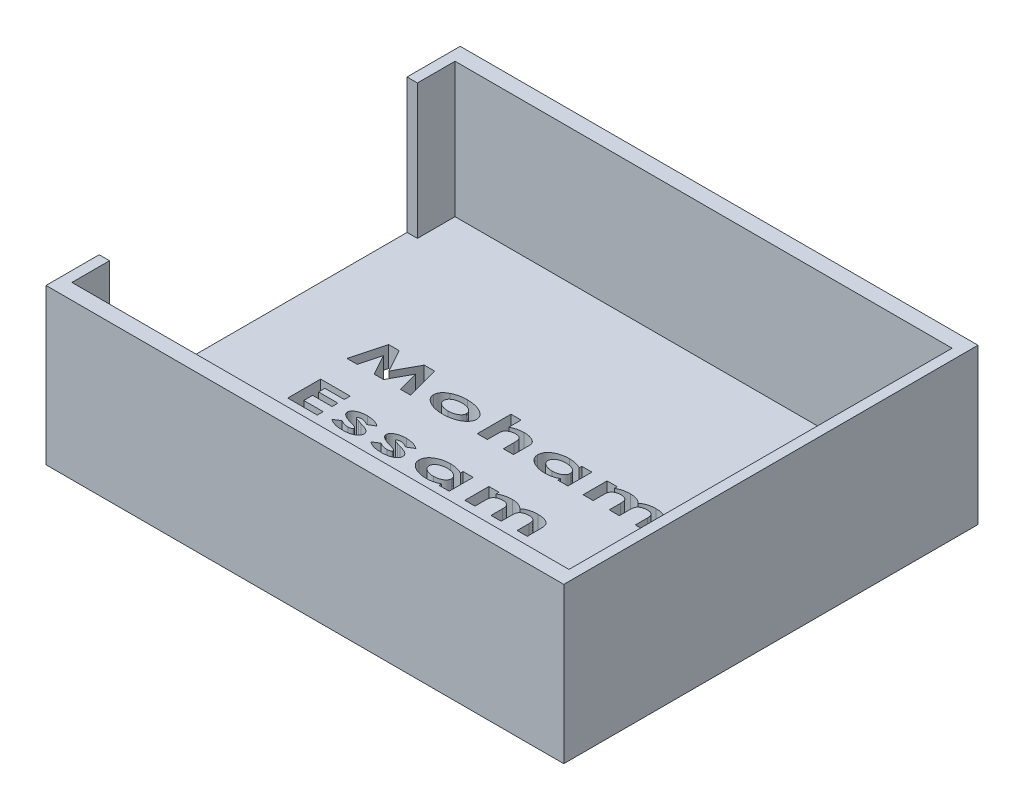
from build123d import *

# Parameters (mm, degrees)
SKETCH1_W           = 50
SKETCH1_H           = 40
BOSS_EXTRUDE1_DEPTH = 15
SKETCH2_W           = 48
SKETCH2_H           = 37
CUT_EXTRUDE1_DEPTH  = 13
SKETCH3_W           = 29.732137494
SKETCH3_H           = 13
CUT_EXTRUDE2_DEPTH  = 12
CUT_EXTRUDE3_DEPTH  = 12


with BuildPart() as part:
    # Sketch1 → Boss-Extrude1 (new body)
    with BuildSketch(Plane(origin=(0, 0, 0), x_dir=(1, 0, 0), z_dir=(0, 1, 0))):
        Rectangle(SKETCH1_W, SKETCH1_H)
    extrude(amount=BOSS_EXTRUDE1_DEPTH)

    # Sketch2 → Cut-Extrude1 (cut)
    with BuildSketch(Plane(origin=(0, 15, 0), x_dir=(1, 0, 0), z_dir=(0, 1, 0))):
        Rectangle(SKETCH2_W, SKETCH2_H)
    extrude(amount=-CUT_EXTRUDE1_DEPTH, mode=Mode.SUBTRACT)

    # Sketch3 → Cut-Extrude2 (cut)
    with BuildSketch(Plane.ZY.offset(25)):
        with Locations((0, 8.5)):
            Rectangle(SKETCH3_W, SKETCH3_H)
    extrude(amount=-CUT_EXTRUDE2_DEPTH, mode=Mode.SUBTRACT)

    # Sketch4 → Cut-Extrude3 (cut)
    # profile 1 of 12: a face of its own
    with BuildSketch(Plane(origin=(0, 2, 0), x_dir=(1, 0, 0), z_dir=(0, 1, 0))):
        Polygon((-16.508154695, 4.600076548), (-15.484802331, 4.600076548), (-14.284001049, 2.385463167), (-13.07683959, 4.600076548), (-12.058575368, 4.600076548), (-11.210763869, 1.425076548), (-12.201679334, 1.425076548), (-12.737206177, 3.43044013), (-13.83052048, 1.425076548), (-14.743205776, 1.425076548), (-15.83079592, 3.43044013), (-16.366958781, 1.425076548), (-17.357238228, 1.425076548), align=None)
    # profile 2 of 12: a face of its own
    with BuildSketch(Plane(origin=(0, 2, 0), x_dir=(1, 0, 0), z_dir=(0, 1, 0))):
        with BuildLine():
            add(Edge.make_bspline(
                [(-8.10000165, 3.785973984), (-8.053562428, 3.785489208), (-7.961468846, 3.784527849), (-7.824403004, 3.776708666), (-7.689529994, 3.763783784), (-7.556586802, 3.74709731), (-7.425933532, 3.72394361), (-7.297468849, 3.695737596), (-7.170741046, 3.6638278), (-7.047494285, 3.62540631), (-6.928283743, 3.58391314), (-6.815009744, 3.538346267), (-6.708702086, 3.488375369), (-6.608307621, 3.436147194), (-6.515853623, 3.378492345), (-6.42901348, 3.318812605), (-6.349761787, 3.254521759), (-6.277181302, 3.187272142), (-6.212381986, 3.117661475), (-6.155908031, 3.046029153), (-6.10815106, 2.973053869), (-6.068835751, 2.898571872), (-6.038053784, 2.822786278), (-6.016320478, 2.745363924), (-6.003220321, 2.666605185), (-6.001413146, 2.613629928), (-6.000507459, 2.587080755)],
                knots=[0, 0, 0, 0, 1.265940792, 2.510486111, 3.741199044, 4.959170855, 6.162116729, 7.356968714, 8.544276639, 9.723439993, 10.875014664, 11.984755685, 13.050035749, 14.076429324, 15.067691783, 16.018447118, 16.947253998, 17.846941071, 18.713956268, 19.537177321, 20.330687547, 21.088166391, 21.829780047, 22.55619397, 23.276419638, 24, 24, 24, 24], degree=3))
            add(Edge.make_bspline(
                [(-6.000507459, 2.587080755), (-6.001435222, 2.560326746), (-6.003286397, 2.506944182), (-6.016063779, 2.427394854), (-6.039069884, 2.349751761), (-6.068647982, 2.272596784), (-6.108608363, 2.197714671), (-6.1568353, 2.123963395), (-6.213642087, 2.051420904), (-6.27883962, 1.980722143), (-6.351618259, 1.91286538), (-6.430303069, 1.847510177), (-6.51675085, 1.78770179), (-6.60817184, 1.72994889), (-6.706583218, 1.677332148), (-6.811206668, 1.628514229), (-6.92175677, 1.582464278), (-7.038479354, 1.541589111), (-7.159703989, 1.504902188), (-7.284384093, 1.472296157), (-7.4121687, 1.445098743), (-7.543069938, 1.422720048), (-7.676976482, 1.405636131), (-7.814056398, 1.393826636), (-7.954045287, 1.385751027), (-8.048472685, 1.384834519), (-8.096185544, 1.38437142)],
                knots=[0, 0, 0, 0, 0.728759206, 1.454101135, 2.18705835, 2.931303608, 3.701078261, 4.493944655, 5.329151475, 6.207866333, 7.110765712, 8.037992116, 8.991287713, 9.971932766, 10.982209905, 12.02848696, 13.115947981, 14.242882043, 15.39562174, 16.565191902, 17.752210956, 18.953195421, 20.181634505, 21.42807642, 22.700442589, 24, 24, 24, 24], degree=3))
            add(Edge.make_bspline(
                [(-8.096185544, 1.38437142), (-8.165963589, 1.385547755), (-8.302946767, 1.387857049), (-8.504543687, 1.403743579), (-8.698240887, 1.431061007), (-8.884343086, 1.469199363), (-9.062872451, 1.517754125), (-9.233037538, 1.578732885), (-9.39600828, 1.64908609), (-9.524972418, 1.717561424), (-9.62240231, 1.776955934), (-9.691063256, 1.82210292), (-9.754301929, 1.86911454), (-9.81321749, 1.916932134), (-9.867395808, 1.965942787), (-9.916895637, 2.016027204), (-9.962026386, 2.067195271), (-10.001707222, 2.120016539), (-10.038050363, 2.173460555), (-10.068113185, 2.228959314), (-10.094732349, 2.284984096), (-10.115534491, 2.342591168), (-10.132305998, 2.400966431), (-10.143652178, 2.460802409), (-10.150832946, 2.521607976), (-10.151897174, 2.562680317), (-10.152430536, 2.583264649)],
                knots=[0, 0, 0, 0, 1.927555344, 3.784036287, 5.582177344, 7.328045527, 9.028781886, 10.688537513, 12.31733635, 13.92860432, 14.717078596, 15.469149608, 16.197730675, 16.892896808, 17.564600043, 18.214792588, 18.837361948, 19.447633942, 20.038893574, 20.620826713, 21.1894036, 21.750816835, 22.310731212, 22.865506817, 23.431423114, 24, 24, 24, 24], degree=3))
            add(Edge.make_bspline(
                [(-10.152430536, 2.583264649), (-10.152007359, 2.605341934), (-10.151166096, 2.649230965), (-10.142384734, 2.714287312), (-10.129241039, 2.777924271), (-10.110548875, 2.839991347), (-10.087045263, 2.900750171), (-10.05760248, 2.960096865), (-10.022398918, 3.017952028), (-9.98218917, 3.07466042), (-9.937050876, 3.130020742), (-9.886417771, 3.183734582), (-9.830324779, 3.235738292), (-9.769101046, 3.286575336), (-9.702984247, 3.336525613), (-9.630590329, 3.383709534), (-9.553938975, 3.431377077), (-9.499633485, 3.460224657), (-9.471891674, 3.474961364)],
                knots=[0, 0, 0, 0, 0.895362313, 1.779955521, 2.659009477, 3.529985937, 4.407059137, 5.299648078, 6.214390826, 7.152461182, 8.118516572, 9.110538608, 10.145320296, 11.220372081, 12.338748077, 13.505510881, 14.725697036, 16, 16, 16, 16], degree=3))
            add(Edge.make_bspline(
                [(-9.471891674, 3.474961364), (-9.421566571, 3.50009899), (-9.320574494, 3.550545007), (-9.162194855, 3.612752277), (-8.998958602, 3.666501531), (-8.830120902, 3.710497895), (-8.655431521, 3.743995745), (-8.475149363, 3.76800533), (-8.289364506, 3.782994341), (-8.163631618, 3.78497276), (-8.10000165, 3.785973984)],
                knots=[0, 0, 0, 0, 0.950148044, 1.906750665, 2.871947648, 3.85293107, 4.852697354, 5.875609384, 6.924904138, 8, 8, 8, 8], degree=3))
        make_face()
        with BuildLine():
            add(Edge.make_bspline(
                [(-8.07837705, 3.256807318), (-8.116757977, 3.256069947), (-8.19212421, 3.254622019), (-8.302699674, 3.24701239), (-8.408074425, 3.23101742), (-8.50899592, 3.211317667), (-8.604649772, 3.184287755), (-8.696056331, 3.152875875), (-8.781576209, 3.113650589), (-8.862005113, 3.070382317), (-8.935200134, 3.022528376), (-8.998813053, 2.970167759), (-9.053981429, 2.915541409), (-9.098082484, 2.856383054), (-9.133144522, 2.794361583), (-9.157419471, 2.728419611), (-9.172504154, 2.659419985), (-9.174500789, 2.612173628), (-9.175507459, 2.58835279)],
                knots=[0, 0, 0, 0, 1.29966981, 2.552080606, 3.748873556, 4.905985143, 6.03097135, 7.111551771, 8.174877936, 9.212306099, 10.201717801, 11.129954838, 11.997870153, 12.823312326, 13.620172785, 14.401461113, 15.194042922, 16, 16, 16, 16], degree=3))
            add(Edge.make_bspline(
                [(-9.175507459, 2.58835279), (-9.174454075, 2.563697822), (-9.172384425, 2.515256632), (-9.158261848, 2.444408375), (-9.13373495, 2.377313221), (-9.09894645, 2.314212554), (-9.055076125, 2.254422904), (-9.001849616, 2.198042925), (-8.93831291, 2.145984075), (-8.865819417, 2.098135538), (-8.786370339, 2.0544479), (-8.700506269, 2.017250089), (-8.610214228, 1.984416146), (-8.514379173, 1.95864523), (-8.413678001, 1.938345456), (-8.307713577, 1.923601065), (-8.196586829, 1.915652268), (-8.120789802, 1.914251416), (-8.082193156, 1.913538087)],
                knots=[0, 0, 0, 0, 0.83184601, 1.634380945, 2.426517084, 3.233281859, 4.05749425, 4.922902993, 5.842558818, 6.822747909, 7.850475165, 8.897933112, 9.977348038, 11.089826779, 12.243123404, 13.442047824, 14.697463782, 16, 16, 16, 16], degree=3))
            add(Edge.make_bspline(
                [(-8.082193156, 1.913538087), (-8.043378166, 1.914162533), (-7.967551664, 1.915382411), (-7.856284595, 1.924514963), (-7.75009272, 1.938995828), (-7.648610368, 1.959048019), (-7.552241009, 1.986061128), (-7.460691956, 2.018167068), (-7.374092403, 2.056596825), (-7.293441262, 2.10060863), (-7.219942048, 2.149220839), (-7.154920144, 2.2011632), (-7.100540867, 2.257622567), (-7.055298944, 2.316880751), (-7.020638612, 2.379998897), (-6.995318805, 2.446232277), (-6.980442226, 2.51624969), (-6.978442938, 2.564114802), (-6.977430536, 2.58835279)],
                knots=[0, 0, 0, 0, 1.303383627, 2.546207562, 3.746413811, 4.901138048, 6.017018097, 7.104649258, 8.156456738, 9.195146267, 10.186416423, 11.112656285, 11.983731231, 12.812460638, 13.609099142, 14.393231776, 15.186362949, 16, 16, 16, 16], degree=3))
            add(Edge.make_bspline(
                [(-6.977430536, 2.58835279), (-6.978493109, 2.612584736), (-6.980589596, 2.66039505), (-6.994707035, 2.73038559), (-7.019038487, 2.796754377), (-7.054237774, 2.858767746), (-7.097844073, 2.918071405), (-7.15175573, 2.973401507), (-7.21545427, 3.024934261), (-7.287533559, 3.073051342), (-7.367584371, 3.115532414), (-7.452895166, 3.154265336), (-7.544190511, 3.185634955), (-7.640633108, 3.21187167), (-7.742459959, 3.231958845), (-7.849677462, 3.246752112), (-7.962289188, 3.254705976), (-8.039144707, 3.256097161), (-8.07837705, 3.256807318)],
                knots=[0, 0, 0, 0, 0.816368961, 1.610719063, 2.394983412, 3.188047637, 4.005291257, 4.869189981, 5.782951973, 6.761698352, 7.784500958, 8.833316183, 9.915489392, 11.033223085, 12.198828477, 13.410141754, 14.677958211, 16, 16, 16, 16], degree=3))
        make_face(mode=Mode.SUBTRACT)
    # profile 3 of 12: a face of its own
    with BuildSketch(Plane(origin=(0, 2, 0), x_dir=(1, 0, 0), z_dir=(0, 1, 0))):
        with BuildLine():
            Line((-4.779353613, 4.681486805), (-3.802430536, 4.681486805))
            Line((-3.802430536, 4.681486805), (-3.802430536, 3.494041893))
            add(Edge.make_bspline(
                [(-3.802430536, 3.494041893), (-3.754162301, 3.517567459), (-3.658421105, 3.564230982), (-3.511393478, 3.622472835), (-3.364617901, 3.673646447), (-3.216832153, 3.714052605), (-3.068430251, 3.746092043), (-2.919334, 3.768830744), (-2.769412815, 3.783600583), (-2.66908147, 3.785181652), (-2.61880173, 3.785973984)],
                knots=[0, 0, 0, 0, 1.047184241, 2.077114959, 3.082937762, 4.078323519, 5.063942948, 6.043145874, 7.019348174, 8, 8, 8, 8], degree=3))
            add(Edge.make_bspline(
                [(-2.61880173, 3.785973984), (-2.570656951, 3.785210247), (-2.476152038, 3.783711082), (-2.337242103, 3.772845341), (-2.204045024, 3.754538321), (-2.07651281, 3.728587774), (-1.954838863, 3.694712612), (-1.83880068, 3.654281608), (-1.728676905, 3.605851682), (-1.659214689, 3.567695317), (-1.624706177, 3.548739409)],
                knots=[0, 0, 0, 0, 1.117423547, 2.193426107, 3.23173755, 4.236375021, 5.211771812, 6.161126484, 7.086456043, 8, 8, 8, 8], degree=3))
            add(Edge.make_bspline(
                [(-1.624706177, 3.548739409), (-1.597035703, 3.531453485), (-1.543190864, 3.497816266), (-1.473006417, 3.436150923), (-1.412060505, 3.370138183), (-1.363702793, 3.296505668), (-1.324723573, 3.217914866), (-1.298434246, 3.132626476), (-1.281043107, 3.041695451), (-1.279503015, 2.978741058), (-1.278712587, 2.946430715)],
                knots=[0, 0, 0, 0, 1.070617537, 2.083348098, 3.060132992, 4.014797615, 4.968368213, 5.933552875, 6.939428801, 8, 8, 8, 8], degree=3))
            Line((-1.278712587, 2.946430715), (-1.278712587, 1.425076548))
            Line((-1.278712587, 1.425076548), (-2.255635664, 1.425076548))
            Line((-2.255635664, 1.425076548), (-2.255635664, 2.433800507))
            add(Edge.make_bspline(
                [(-2.255635664, 2.433800507), (-2.255978867, 2.465814564), (-2.256635831, 2.527096222), (-2.258855991, 2.615124563), (-2.263668175, 2.695142185), (-2.271655901, 2.766970876), (-2.279874189, 2.830810835), (-2.291478067, 2.886413362), (-2.304402805, 2.934180506), (-2.324422562, 2.986798075), (-2.358204734, 3.043080811), (-2.408592325, 3.102042787), (-2.472336499, 3.15029738), (-2.546560296, 3.189536804), (-2.631322963, 3.219611948), (-2.725294817, 3.241989344), (-2.8287883, 3.254251468), (-2.900738844, 3.255934033), (-2.938082579, 3.256807318)],
                knots=[0, 0, 0, 0, 1.214604203, 2.325008643, 3.340471166, 4.254444062, 5.066591082, 5.781154523, 6.407582209, 6.942307686, 7.912051765, 8.8812954, 9.86747727, 10.925372826, 12.055067994, 13.270444228, 14.583307364, 16, 16, 16, 16], degree=3))
            add(Edge.make_bspline(
                [(-2.938082579, 3.256807318), (-2.986944743, 3.255702536), (-3.081402615, 3.253566828), (-3.217526598, 3.230382976), (-3.343253921, 3.194752909), (-3.439539583, 3.151850829), (-3.509602071, 3.110966192), (-3.557595285, 3.077697126), (-3.60159138, 3.041972579), (-3.642067203, 3.003915185), (-3.677454101, 2.962469039), (-3.709056397, 2.918730372), (-3.736644496, 2.872448907), (-3.751237109, 2.839529736), (-3.75854532, 2.823043295)],
                knots=[0, 0, 0, 0, 1.786373901, 3.453328002, 5.036886462, 6.557944362, 7.295074526, 8.003093406, 8.692506419, 9.367450294, 10.033055663, 10.683292504, 11.340572076, 12, 12, 12, 12], degree=3))
            add(Edge.make_bspline(
                [(-3.75854532, 2.823043295), (-3.762151731, 2.813142464), (-3.770304291, 2.790760903), (-3.778379298, 2.75201272), (-3.786071989, 2.705137243), (-3.792348553, 2.650163871), (-3.796284317, 2.586682709), (-3.800495336, 2.515048046), (-3.80203141, 2.434866712), (-3.802293224, 2.378678737), (-3.802430536, 2.349210162)],
                knots=[0, 0, 0, 0, 0.52871769, 1.195205431, 1.98302743, 2.915604534, 3.972503553, 5.177553842, 6.51972836, 8, 8, 8, 8], degree=3))
            Line((-3.802430536, 2.349210162), (-3.802430536, 1.425076548))
            Line((-3.802430536, 1.425076548), (-4.779353613, 1.425076548))
            Line((-4.779353613, 1.425076548), (-4.779353613, 4.681486805))
        make_face()
    # profile 4 of 12: a face of its own
    with BuildSketch(Plane(origin=(0, 2, 0), x_dir=(1, 0, 0), z_dir=(0, 1, 0))):
        with BuildLine():
            Line((2.995325874, 3.745268856), (3.972248951, 3.745268856))
            Line((3.972248951, 3.745268856), (3.972248951, 1.425076548))
            Line((3.972248951, 1.425076548), (2.995325874, 1.425076548))
            Line((2.995325874, 1.425076548), (2.995325874, 1.678211564))
            add(Edge.make_bspline(
                [(2.995325874, 1.678211564), (2.947300324, 1.653390886), (2.852420162, 1.604354697), (2.70643005, 1.543011166), (2.560569336, 1.491805685), (2.413559315, 1.451159568), (2.263370866, 1.42153732), (2.108398451, 1.399750397), (1.947171408, 1.387005208), (1.837584151, 1.385259822), (1.78180424, 1.38437142)],
                knots=[0, 0, 0, 0, 1.027553614, 2.030053863, 3.007864281, 3.965262658, 4.927359277, 5.916438133, 6.939467064, 8, 8, 8, 8], degree=3))
            add(Edge.make_bspline(
                [(1.78180424, 1.38437142), (1.719221899, 1.385204295), (1.595738698, 1.386847666), (1.413962117, 1.404174308), (1.238409594, 1.430437699), (1.069420995, 1.46797961), (0.907109305, 1.516397189), (0.750842902, 1.574919664), (0.6015578, 1.645066692), (0.4599508, 1.72442163), (0.33009713, 1.811413871), (0.215612836, 1.904906966), (0.119450772, 2.004903354), (0.039726039, 2.109296174), (-0.022659413, 2.219298687), (-0.066049924, 2.335207353), (-0.093122778, 2.456301452), (-0.096541103, 2.539028047), (-0.098263869, 2.580720579)],
                knots=[0, 0, 0, 0, 1.224805302, 2.416702144, 3.571284783, 4.698058809, 5.802404654, 6.884685225, 7.961580786, 9.028246638, 10.059649902, 11.01777119, 11.915975851, 12.769295614, 13.583199471, 14.381795368, 15.184457582, 16, 16, 16, 16], degree=3))
            add(Edge.make_bspline(
                [(-0.098263869, 2.580720579), (-0.096791703, 2.623893739), (-0.093885981, 2.709107746), (-0.067212236, 2.833643694), (-0.025378412, 2.952500284), (0.034721802, 3.064691768), (0.111611417, 3.17068486), (0.205105491, 3.270648019), (0.315475481, 3.364610187), (0.441789925, 3.450382744), (0.579085374, 3.5292006), (0.725380214, 3.598229826), (0.879129059, 3.655828746), (1.039716462, 3.703782007), (1.20772967, 3.740442357), (1.382752095, 3.767054619), (1.565248327, 3.783325353), (1.689335716, 3.785080096), (1.752547429, 3.785973984)],
                knots=[0, 0, 0, 0, 0.847675446, 1.673118693, 2.491643028, 3.317485898, 4.165243284, 5.058669081, 6.001535452, 7.008327328, 8.055523617, 9.110616778, 10.184123057, 11.279781004, 12.402090599, 13.561360268, 14.757725533, 16, 16, 16, 16], degree=3))
            add(Edge.make_bspline(
                [(1.752547429, 3.785973984), (1.810883778, 3.785259522), (1.926050768, 3.783849038), (2.095679719, 3.768463997), (2.259937376, 3.74537098), (2.418323347, 3.712055025), (2.571771046, 3.670422783), (2.718852071, 3.618047751), (2.860887333, 3.557326185), (2.950531579, 3.508342332), (2.995325874, 3.483865611)],
                knots=[0, 0, 0, 0, 1.082135589, 2.136340387, 3.157741361, 4.15837997, 5.137531756, 6.105493595, 7.0533349, 8, 8, 8, 8], degree=3))
            Line((2.995325874, 3.483865611), (2.995325874, 3.745268856))
        make_face()
        with BuildLine():
            add(Edge.make_bspline(
                [(1.948440858, 3.256807318), (1.91090248, 3.256102519), (1.837219446, 3.25471909), (1.729075307, 3.246645437), (1.625756964, 3.232224979), (1.527754532, 3.210902899), (1.434226193, 3.185170859), (1.345813102, 3.152653232), (1.262087147, 3.114291851), (1.183781952, 3.071065642), (1.112788811, 3.022834003), (1.049716193, 2.971739027), (0.997384125, 2.915965078), (0.953961369, 2.857430425), (0.919682079, 2.795590955), (0.896301222, 2.729565865), (0.88082061, 2.660730255), (0.879383541, 2.613453803), (0.878659208, 2.589624826)],
                knots=[0, 0, 0, 0, 1.293006799, 2.538006873, 3.732827882, 4.882897014, 5.990259798, 7.071430873, 8.123582826, 9.15980222, 10.148166556, 11.076581636, 11.949585223, 12.774767288, 13.581917549, 14.374232595, 15.180556654, 16, 16, 16, 16], degree=3))
            add(Edge.make_bspline(
                [(0.878659208, 2.589624826), (0.87973572, 2.565606943), (0.881868934, 2.518013192), (0.895912971, 2.448216781), (0.920413313, 2.381726417), (0.955433209, 2.319217628), (0.999055713, 2.259292387), (1.052933784, 2.203284495), (1.11682745, 2.15117508), (1.188681209, 2.101724032), (1.268353098, 2.058215748), (1.35263108, 2.018740279), (1.441825997, 1.986804245), (1.535253293, 1.95983757), (1.633002497, 1.938908856), (1.735454512, 1.92450421), (1.842062417, 1.915430995), (1.914713467, 1.914175759), (1.951620947, 1.913538087)],
                knots=[0, 0, 0, 0, 0.823137513, 1.631126345, 2.428856255, 3.241893539, 4.079023421, 4.962996737, 5.897065893, 6.900751006, 7.948094805, 9.004698541, 10.08736471, 11.191255728, 12.335655896, 13.510200981, 14.735156544, 16, 16, 16, 16], degree=3))
            add(Edge.make_bspline(
                [(1.951620947, 1.913538087), (1.989795853, 1.914234961), (2.06453894, 1.915599378), (2.174365893, 1.923758372), (2.279184252, 1.938044239), (2.378850227, 1.959527164), (2.473605337, 1.98510239), (2.563410417, 2.017072131), (2.648001725, 2.055275138), (2.727288768, 2.098830887), (2.799299604, 2.147066749), (2.862384955, 2.199736144), (2.916456318, 2.255525731), (2.959992573, 2.315904325), (2.994311456, 2.379533917), (3.018802738, 2.446959118), (3.03285915, 2.518235209), (3.034964188, 2.566880078), (3.036031003, 2.591532878)],
                knots=[0, 0, 0, 0, 1.293771481, 2.533090066, 3.730052094, 4.875691813, 5.986023996, 7.054128431, 8.102451667, 9.128301026, 10.116707372, 11.034794878, 11.908869355, 12.742435584, 13.54925274, 14.351546462, 15.164577963, 16, 16, 16, 16], degree=3))
            add(Edge.make_bspline(
                [(3.036031003, 2.591532878), (3.034979452, 2.615764428), (3.032913731, 2.663366154), (3.018727457, 2.733162524), (2.994107231, 2.799215906), (2.960349014, 2.861931552), (2.91617316, 2.920633139), (2.862162216, 2.975062377), (2.799473735, 3.027192494), (2.727042568, 3.07394125), (2.648018528, 3.117047542), (2.56309993, 3.154582575), (2.473130561, 3.186311024), (2.378193079, 3.212596642), (2.277724214, 3.231825391), (2.172483832, 3.246723121), (2.061986604, 3.254708938), (1.986825153, 3.256097957), (1.948440858, 3.256807318)],
                knots=[0, 0, 0, 0, 0.824671937, 1.620028775, 2.412269577, 3.216254686, 4.036018289, 4.90352652, 5.82100837, 6.805724672, 7.8325851, 8.882538578, 9.962105007, 11.077285013, 12.232105333, 13.441440944, 14.693366331, 16, 16, 16, 16], degree=3))
        make_face(mode=Mode.SUBTRACT)
    # profile 5 of 12: a face of its own
    with BuildSketch(Plane(origin=(0, 2, 0), x_dir=(1, 0, 0), z_dir=(0, 1, 0))):
        with BuildLine():
            Line((5.437633567, 3.745268856), (6.414556644, 3.745268856))
            Line((6.414556644, 3.745268856), (6.414556644, 3.46796517))
            add(Edge.make_bspline(
                [(6.414556644, 3.46796517), (6.457606353, 3.493737866), (6.544131097, 3.545537888), (6.682368805, 3.609947203), (6.82711959, 3.664854777), (6.978971194, 3.709366428), (7.13782718, 3.7434549), (7.303491443, 3.768275031), (7.476226288, 3.782999817), (7.593704843, 3.784970574), (7.653518983, 3.785973984)],
                knots=[0, 0, 0, 0, 0.928492069, 1.866157527, 2.819023524, 3.792835013, 4.792976067, 5.824993516, 6.892596658, 8, 8, 8, 8], degree=3))
            add(Edge.make_bspline(
                [(7.653518983, 3.785973984), (7.713570353, 3.784841427), (7.831254973, 3.782621919), (8.003012979, 3.762672273), (8.16582317, 3.729596451), (8.294693093, 3.691009445), (8.392118658, 3.653062034), (8.461679435, 3.623227742), (8.526569875, 3.588198367), (8.588608772, 3.551483299), (8.646879063, 3.511611643), (8.701577896, 3.468587771), (8.75234582, 3.422406174), (8.783512515, 3.389099326), (8.798986732, 3.372562526)],
                knots=[0, 0, 0, 0, 1.724418423, 3.379398793, 4.958225664, 6.491656286, 7.235778459, 7.961048813, 8.663857899, 9.352084907, 10.031090297, 10.69016989, 11.349671331, 12, 12, 12, 12], degree=3))
            add(Edge.make_bspline(
                [(8.798986732, 3.372562526), (8.839815727, 3.405383068), (8.922349064, 3.471727805), (9.061952721, 3.553960878), (9.213405822, 3.625474121), (9.378160761, 3.683373938), (9.552975146, 3.729612918), (9.736756265, 3.762379273), (9.928307859, 3.782646092), (10.058674304, 3.784850864), (10.125083487, 3.785973984)],
                knots=[0, 0, 0, 0, 0.885912443, 1.790818283, 2.734967203, 3.71815572, 4.742904095, 5.793374269, 6.875936137, 8, 8, 8, 8], degree=3))
            add(Edge.make_bspline(
                [(10.125083487, 3.785973984), (10.159645904, 3.785558821), (10.22774778, 3.784740782), (10.328116769, 3.779739273), (10.425307375, 3.77086524), (10.519257916, 3.758022807), (10.610365257, 3.742337954), (10.69808244, 3.722766571), (10.782415917, 3.698906356), (10.86328984, 3.672455034), (10.940042968, 3.643480613), (11.011494931, 3.611797385), (11.077106697, 3.577177453), (11.13754641, 3.541375489), (11.192178991, 3.502850919), (11.241114968, 3.462259036), (11.28486584, 3.419558078), (11.323003487, 3.373537106), (11.357041473, 3.323326465), (11.384748443, 3.265666054), (11.408898033, 3.201417564), (11.428378752, 3.129841313), (11.443625387, 3.051180202), (11.453878096, 2.965295658), (11.461376283, 2.872360029), (11.461782386, 2.808007693), (11.461992541, 2.774705955)],
                knots=[0, 0, 0, 0, 1.289291102, 2.540422463, 3.747590693, 4.92867586, 6.076732526, 7.195292088, 8.279438393, 9.344817614, 10.368553605, 11.33855308, 12.258279101, 13.134438041, 13.957256052, 14.74908619, 15.504040245, 16.234103687, 16.975473436, 17.760640756, 18.614054403, 19.533100153, 20.52418037, 21.60024899, 22.758151088, 24, 24, 24, 24], degree=3))
            Line((11.461992541, 2.774705955), (11.461992541, 1.425076548))
            Line((11.461992541, 1.425076548), (10.485069464, 1.425076548))
            Line((10.485069464, 1.425076548), (10.485069464, 2.590260843))
            add(Edge.make_bspline(
                [(10.485069464, 2.590260843), (10.484683146, 2.621447317), (10.483940536, 2.681396269), (10.4755131, 2.767254332), (10.462456819, 2.845366809), (10.444087343, 2.915661544), (10.421066894, 2.978587513), (10.391403026, 3.033165994), (10.357248148, 3.080612188), (10.315930881, 3.119170133), (10.270135523, 3.151852375), (10.219241069, 3.179966074), (10.163225444, 3.204023405), (10.101958463, 3.223867346), (10.035178191, 3.238122451), (9.963371973, 3.248709446), (9.886306594, 3.256154078), (9.833170061, 3.256585248), (9.805802637, 3.256807318)],
                knots=[0, 0, 0, 0, 1.348092376, 2.591403118, 3.726261935, 4.769120742, 5.729414895, 6.615424195, 7.447833497, 8.245388874, 9.046781074, 9.875750653, 10.754473844, 11.679281639, 12.655717778, 13.703280238, 14.817098143, 16, 16, 16, 16], degree=3))
            add(Edge.make_bspline(
                [(9.805802637, 3.256807318), (9.763773062, 3.255929051), (9.681728377, 3.254214612), (9.561980938, 3.237948821), (9.448876338, 3.211255522), (9.34329239, 3.174775903), (9.247224819, 3.129693366), (9.163372062, 3.075495124), (9.092969722, 3.012386991), (9.044418864, 2.952484977), (9.012387763, 2.89888599), (8.993302388, 2.852542945), (8.975697181, 2.801281225), (8.962192083, 2.744148132), (8.951235977, 2.681291031), (8.944168285, 2.612851885), (8.938548315, 2.538835041), (8.93836801, 2.48766241), (8.938274592, 2.461149265)],
                knots=[0, 0, 0, 0, 1.485092214, 2.89900437, 4.262337849, 5.587228045, 6.840936878, 8.004976307, 9.103480475, 10.169734639, 10.717284049, 11.304766602, 11.937540181, 12.631890893, 13.377305733, 14.19167655, 15.063086222, 16, 16, 16, 16], degree=3))
            Line((8.938274592, 2.461149265), (8.938274592, 1.425076548))
            Line((8.938274592, 1.425076548), (7.961351515, 1.425076548))
            Line((7.961351515, 1.425076548), (7.961351515, 2.53747138))
            add(Edge.make_bspline(
                [(7.961351515, 2.53747138), (7.961155257, 2.562284287), (7.960777583, 2.610033384), (7.956573108, 2.678940671), (7.951551557, 2.742733698), (7.94213553, 2.801186337), (7.932130946, 2.85479128), (7.917637868, 2.90259396), (7.902335942, 2.945495658), (7.877386029, 2.994639341), (7.840528865, 3.049539347), (7.785617016, 3.106070686), (7.720993579, 3.153828504), (7.646648955, 3.191707226), (7.563494609, 3.220691622), (7.47258738, 3.242508798), (7.372908722, 3.25410484), (7.303948635, 3.255882835), (7.268092301, 3.256807318)],
                knots=[0, 0, 0, 0, 1.023877294, 1.970313919, 2.848831416, 3.663081015, 4.412965741, 5.096851674, 5.722570136, 6.289960045, 7.367466338, 8.437986872, 9.526485706, 10.669198793, 11.867539458, 13.153642433, 14.52001424, 16, 16, 16, 16], degree=3))
            add(Edge.make_bspline(
                [(7.268092301, 3.256807318), (7.227532711, 3.256007443), (7.148176562, 3.254442462), (7.032175799, 3.236942354), (6.921647209, 3.21069832), (6.817909238, 3.173470875), (6.723286195, 3.126962123), (6.63989088, 3.071512163), (6.569888679, 3.006545583), (6.521031359, 2.945152131), (6.489638755, 2.88991723), (6.46910197, 2.84284612), (6.452314157, 2.790129195), (6.438406781, 2.732084791), (6.427543071, 2.668559544), (6.420445581, 2.599496697), (6.414833033, 2.524841197), (6.414650954, 2.473245673), (6.414556644, 2.446520859)],
                knots=[0, 0, 0, 0, 1.435780243, 2.809150516, 4.146225197, 5.455245645, 6.704737693, 7.8733525, 8.989427018, 10.075661758, 10.637401591, 11.2360384, 11.891571272, 12.59472446, 13.349155542, 14.172755911, 15.053546593, 16, 16, 16, 16], degree=3))
            Line((6.414556644, 2.446520859), (6.414556644, 1.425076548))
            Line((6.414556644, 1.425076548), (5.437633567, 1.425076548))
            Line((5.437633567, 1.425076548), (5.437633567, 3.745268856))
        make_face()
    # profile 6 of 12: a face of its own
    with BuildSketch(Plane(origin=(0, 2, 0), x_dir=(1, 0, 0), z_dir=(0, 1, 0))):
        with BuildLine():
            Line((16.749843102, 2.442704753), (13.53795408, 2.442704753))
            add(Edge.make_bspline(
                [(13.53795408, 2.442704753), (13.544448558, 2.421321592), (13.557399924, 2.37867904), (13.585895867, 2.317789773), (13.62161334, 2.260401647), (13.664781513, 2.206661844), (13.71474382, 2.156004567), (13.772370164, 2.109123339), (13.836716979, 2.065085637), (13.908200363, 2.025279406), (13.98546467, 1.9891032), (14.068599945, 1.957820541), (14.156979172, 1.932178221), (14.250377875, 1.910409332), (14.348886884, 1.893279073), (14.452725747, 1.881336173), (14.561634775, 1.874387462), (14.635922428, 1.873358654), (14.673881563, 1.872832959)],
                knots=[0, 0, 0, 0, 0.786567428, 1.568582017, 2.360345798, 3.162922845, 3.992168549, 4.86248197, 5.776141927, 6.735990573, 7.741820601, 8.77953937, 9.862019899, 10.981742977, 12.156944808, 13.382711859, 14.662631146, 16, 16, 16, 16], degree=3))
            add(Edge.make_bspline(
                [(14.673881563, 1.872832959), (14.719490362, 1.873525619), (14.809370698, 1.874890632), (14.941421967, 1.886856038), (15.068832436, 1.904707136), (15.191033267, 1.931943408), (15.308804665, 1.965072569), (15.421307567, 2.006950481), (15.529263566, 2.055371788), (15.597254047, 2.094441441), (15.631088094, 2.11388364)],
                knots=[0, 0, 0, 0, 1.095102012, 2.158095343, 3.182009107, 4.182695928, 5.162518364, 6.117784912, 7.06335487, 8, 8, 8, 8], degree=3))
            Line((15.631088094, 2.11388364), (16.46872331, 1.886825346))
            add(Edge.make_bspline(
                [(16.46872331, 1.886825346), (16.442470972, 1.865927325), (16.389616793, 1.823853064), (16.305462291, 1.766590998), (16.218348805, 1.712139777), (16.127073543, 1.662346903), (16.031496128, 1.61747048), (15.932480905, 1.576042503), (15.829456719, 1.539137209), (15.722594124, 1.505896536), (15.6110571, 1.477479573), (15.494737846, 1.45276083), (15.373698291, 1.430950444), (15.247187422, 1.414003039), (15.115670815, 1.40068751), (14.979067968, 1.39129905), (14.837390368, 1.385406616), (14.741305369, 1.384720942), (14.692326075, 1.38437142)],
                knots=[0, 0, 0, 0, 0.854656117, 1.720690401, 2.591579468, 3.471451391, 4.367880879, 5.280759393, 6.205135892, 7.155089069, 8.131129648, 9.136547434, 10.184481071, 11.263905519, 12.387785859, 13.551963195, 14.752114086, 16, 16, 16, 16], degree=3))
            add(Edge.make_bspline(
                [(14.692326075, 1.38437142), (14.61682306, 1.385251678), (14.469456921, 1.386969757), (14.253722618, 1.403169833), (14.048824797, 1.429701988), (13.854344149, 1.466247237), (13.670628116, 1.51375417), (13.497720518, 1.572542459), (13.335074915, 1.640741512), (13.208295186, 1.707589989), (13.113923229, 1.765474789), (13.047786245, 1.809610987), (12.986250492, 1.855026396), (12.929514694, 1.902583988), (12.876384073, 1.950483727), (12.828923682, 2.000770011), (12.786019934, 2.052111926), (12.746879152, 2.104237319), (12.712668532, 2.158053002), (12.683217262, 2.213465933), (12.657540504, 2.269765782), (12.637292718, 2.327977904), (12.621349916, 2.387280341), (12.609686021, 2.447828969), (12.603523275, 2.509783215), (12.602335002, 2.551451951), (12.601736131, 2.57245235)],
                knots=[0, 0, 0, 0, 2.054637344, 4.010223575, 5.883900568, 7.67528703, 9.392469401, 11.043787565, 12.641659938, 14.187696022, 14.938793558, 15.654133515, 16.351157691, 17.019008305, 17.668357262, 18.296889738, 18.898991017, 19.488689177, 20.069742437, 20.632487212, 21.195498151, 21.752086024, 22.307745975, 22.865648247, 23.428304273, 24, 24, 24, 24], degree=3))
            add(Edge.make_bspline(
                [(12.601736131, 2.57245235), (12.602332207, 2.594087859), (12.603509325, 2.636813184), (12.609652704, 2.700258532), (12.621512049, 2.76222833), (12.636945964, 2.823249248), (12.658397323, 2.882289876), (12.683182463, 2.940323562), (12.713198787, 2.996403181), (12.746912436, 3.051768979), (12.786246308, 3.10504948), (12.828923576, 3.157854314), (12.877438373, 3.208402292), (12.930086515, 3.257609224), (12.986675544, 3.306438883), (13.048700227, 3.352564108), (13.114893581, 3.397771167), (13.20953648, 3.456625826), (13.335890443, 3.523707109), (13.495859669, 3.594895957), (13.6656007, 3.653704677), (13.844408912, 3.701868997), (14.032318871, 3.740371948), (14.229800913, 3.766159664), (14.436121642, 3.783582508), (14.576745112, 3.785166433), (14.648440858, 3.785973984)],
                knots=[0, 0, 0, 0, 0.59475654, 1.174512067, 1.749327909, 2.327324109, 2.902287578, 3.473786577, 4.060208354, 4.648796988, 5.253656213, 5.878828358, 6.513512342, 7.177141678, 7.859037603, 8.56637178, 9.300067322, 10.06157577, 11.628213237, 13.227278867, 14.869113045, 16.559552067, 18.31355121, 20.136258155, 22.030102268, 24, 24, 24, 24], degree=3))
            add(Edge.make_bspline(
                [(14.648440858, 3.785973984), (14.724579097, 3.785091768), (14.87321416, 3.783369529), (15.090860582, 3.767188077), (15.297429478, 3.740608033), (15.493553214, 3.704399344), (15.678105148, 3.655454358), (15.852574984, 3.598501334), (16.015346872, 3.528463614), (16.142970856, 3.462012727), (16.238653871, 3.404362479), (16.304787483, 3.35891178), (16.366834317, 3.312577986), (16.424162518, 3.264146955), (16.476947553, 3.214123296), (16.524889799, 3.162059595), (16.569067487, 3.109002022), (16.60761857, 3.053354077), (16.642524181, 2.996783602), (16.671495473, 2.937712552), (16.697296551, 2.877649175), (16.717494897, 2.815142302), (16.734141283, 2.751519102), (16.745774949, 2.685813952), (16.751862736, 2.618574168), (16.753057408, 2.573099163), (16.753659208, 2.550191733)],
                knots=[0, 0, 0, 0, 2.029511591, 3.961959, 5.814079258, 7.579885766, 9.274267069, 10.900679463, 12.468041757, 13.992423862, 14.732964908, 15.444669546, 16.130802943, 16.796568661, 17.444190739, 18.068097756, 18.682486005, 19.283018142, 19.871379064, 20.452721621, 21.035299181, 21.612588984, 22.202034743, 22.78742928, 23.389183579, 24, 24, 24, 24], degree=3))
            Line((16.753659208, 2.550191733), (16.749843102, 2.442704753))
        make_face()
        with BuildLine():
            add(Edge.make_bspline(
                [(15.776736131, 2.890461164), (15.76776364, 2.90533475), (15.749441405, 2.935707293), (15.714430466, 2.977686533), (15.673532385, 3.017691168), (15.626992286, 3.055869961), (15.57438831, 3.091938945), (15.514836665, 3.124318401), (15.450201382, 3.156432019), (15.354399684, 3.195690032), (15.224884161, 3.23723106), (15.058528473, 3.272690348), (14.880283414, 3.293762127), (14.757470464, 3.296237749), (14.694234128, 3.297512446)],
                knots=[0, 0, 0, 0, 0.519484763, 1.060811651, 1.630890397, 2.230728536, 2.861063099, 3.537438778, 4.258537692, 5.021268243, 6.63529307, 8.323605869, 10.107026209, 12, 12, 12, 12], degree=3))
            add(Edge.make_bspline(
                [(14.694234128, 3.297512446), (14.659458443, 3.29714172), (14.590918989, 3.296411055), (14.489669861, 3.290758291), (14.391859662, 3.280533952), (14.29722233, 3.266488032), (14.205918287, 3.24886079), (14.117570082, 3.227159381), (14.032561757, 3.201418605), (13.97775745, 3.180583971), (13.95072952, 3.17030892)],
                knots=[0, 0, 0, 0, 1.09988735, 2.167769823, 3.205976562, 4.209296305, 5.192974042, 6.146005846, 7.085662686, 8, 8, 8, 8], degree=3))
            add(Edge.make_bspline(
                [(13.95072952, 3.17030892), (13.917360708, 3.155565115), (13.849344542, 3.125512587), (13.754405183, 3.06113795), (13.661940931, 2.983767446), (13.606960699, 2.922169284), (13.578659208, 2.890461164)],
                knots=[0, 0, 0, 0, 0.929626688, 1.894872474, 2.916369654, 4, 4, 4, 4], degree=3))
            Line((13.578659208, 2.890461164), (15.776736131, 2.890461164))
        make_face(mode=Mode.SUBTRACT)
    # profile 7 of 12: a face of its own
    with BuildSketch(Plane(origin=(0, 2, 0), x_dir=(1, 0, 0), z_dir=(0, 1, 0))):
        with BuildLine():
            Line((20.864877156, 4.681486805), (21.841800233, 4.681486805))
            Line((21.841800233, 4.681486805), (21.841800233, 1.425076548))
            Line((21.841800233, 1.425076548), (20.864877156, 1.425076548))
            Line((20.864877156, 1.425076548), (20.864877156, 1.678211564))
            add(Edge.make_bspline(
                [(20.864877156, 1.678211564), (20.816851606, 1.653390886), (20.721971445, 1.604354697), (20.575981332, 1.543011166), (20.430120618, 1.491805685), (20.283110597, 1.451159568), (20.132922148, 1.42153732), (19.977949733, 1.399750397), (19.81672269, 1.387005208), (19.707135433, 1.385259822), (19.651355522, 1.38437142)],
                knots=[0, 0, 0, 0, 1.027553614, 2.030053863, 3.007864281, 3.965262658, 4.927359277, 5.916438133, 6.939467064, 8, 8, 8, 8], degree=3))
            add(Edge.make_bspline(
                [(19.651355522, 1.38437142), (19.588773181, 1.385204295), (19.46528998, 1.386847666), (19.283513399, 1.404174308), (19.107960876, 1.430437699), (18.938972277, 1.46797961), (18.776660587, 1.516397189), (18.620394184, 1.574919664), (18.471109082, 1.645066692), (18.329502082, 1.72442163), (18.199648413, 1.811413871), (18.085164118, 1.904906966), (17.989002054, 2.004903354), (17.909277321, 2.109296174), (17.846891869, 2.219298687), (17.803501359, 2.335207353), (17.776428504, 2.456301452), (17.773010179, 2.539028047), (17.771287413, 2.580720579)],
                knots=[0, 0, 0, 0, 1.224805302, 2.416702144, 3.571284783, 4.698058809, 5.802404654, 6.884685225, 7.961580786, 9.028246638, 10.059649902, 11.01777119, 11.915975851, 12.769295614, 13.583199471, 14.381795368, 15.184457582, 16, 16, 16, 16], degree=3))
            add(Edge.make_bspline(
                [(17.771287413, 2.580720579), (17.772759579, 2.623893739), (17.775665301, 2.709107746), (17.802339046, 2.833643694), (17.84417287, 2.952500284), (17.904273084, 3.064691768), (17.981162699, 3.17068486), (18.074656773, 3.270648019), (18.185026763, 3.364610187), (18.311341207, 3.450382744), (18.448636656, 3.5292006), (18.594931496, 3.598229826), (18.748680341, 3.655828746), (18.909267744, 3.703782007), (19.077280953, 3.740442357), (19.252303377, 3.767054619), (19.434799609, 3.783325353), (19.558886998, 3.785080096), (19.622098711, 3.785973984)],
                knots=[0, 0, 0, 0, 0.847675446, 1.673118693, 2.491643028, 3.317485898, 4.165243284, 5.058669081, 6.001535452, 7.008327328, 8.055523617, 9.110616778, 10.184123057, 11.279781004, 12.402090599, 13.561360268, 14.757725533, 16, 16, 16, 16], degree=3))
            add(Edge.make_bspline(
                [(19.622098711, 3.785973984), (19.680421226, 3.78487609), (19.795537474, 3.782709081), (19.965398269, 3.769167282), (20.129404336, 3.743660372), (20.288132836, 3.710618055), (20.441218885, 3.666293474), (20.588613183, 3.613159288), (20.730480523, 3.550239888), (20.820084393, 3.50005078), (20.864877156, 3.474961364)],
                knots=[0, 0, 0, 0, 1.079827049, 2.13134906, 3.151618263, 4.150832997, 5.13098708, 6.09943248, 7.049910777, 8, 8, 8, 8], degree=3))
            Line((20.864877156, 3.474961364), (20.864877156, 4.681486805))
        make_face()
        with BuildLine():
            add(Edge.make_bspline(
                [(19.81799214, 3.256807318), (19.780453762, 3.256102519), (19.706770728, 3.25471909), (19.598626589, 3.246645437), (19.495308246, 3.232224979), (19.397305814, 3.210902899), (19.303777475, 3.185170859), (19.215364384, 3.152653232), (19.131638429, 3.114291851), (19.053333234, 3.071065642), (18.982340093, 3.022834003), (18.919267475, 2.971739027), (18.866935407, 2.915965078), (18.823512651, 2.857430425), (18.789233361, 2.795590955), (18.765852504, 2.729565865), (18.750371893, 2.660730255), (18.748934823, 2.613453803), (18.74821049, 2.589624826)],
                knots=[0, 0, 0, 0, 1.293006799, 2.538006873, 3.732827882, 4.882897014, 5.990259798, 7.071430873, 8.123582826, 9.15980222, 10.148166556, 11.076581636, 11.949585223, 12.774767288, 13.581917549, 14.374232595, 15.180556654, 16, 16, 16, 16], degree=3))
            add(Edge.make_bspline(
                [(18.74821049, 2.589624826), (18.749287003, 2.565606943), (18.751420216, 2.518013192), (18.765464253, 2.448216781), (18.789964595, 2.381726417), (18.824984491, 2.319217628), (18.868606995, 2.259292387), (18.922485066, 2.203284495), (18.986378732, 2.15117508), (19.058232491, 2.101724032), (19.13790438, 2.058215748), (19.222182362, 2.018740279), (19.311377279, 1.986804245), (19.404804575, 1.95983757), (19.502553779, 1.938908856), (19.605005794, 1.92450421), (19.711613699, 1.915430995), (19.784264749, 1.914175759), (19.821172229, 1.913538087)],
                knots=[0, 0, 0, 0, 0.823137513, 1.631126345, 2.428856255, 3.241893539, 4.079023421, 4.962996737, 5.897065893, 6.900751006, 7.948094805, 9.004698541, 10.08736471, 11.191255728, 12.335655896, 13.510200981, 14.735156544, 16, 16, 16, 16], degree=3))
            add(Edge.make_bspline(
                [(19.821172229, 1.913538087), (19.859347135, 1.914234961), (19.934090222, 1.915599378), (20.043917175, 1.923758372), (20.148735534, 1.938044239), (20.248401509, 1.959527164), (20.343156619, 1.98510239), (20.432961699, 2.017072131), (20.517553007, 2.055275138), (20.59684005, 2.098830887), (20.668850886, 2.147066749), (20.731936237, 2.199736144), (20.7860076, 2.255525731), (20.829543855, 2.315904325), (20.863862738, 2.379533917), (20.88835402, 2.446959118), (20.902410432, 2.518235209), (20.90451547, 2.566880078), (20.905582285, 2.591532878)],
                knots=[0, 0, 0, 0, 1.293771481, 2.533090066, 3.730052094, 4.875691813, 5.986023996, 7.054128431, 8.102451667, 9.128301026, 10.116707372, 11.034794878, 11.908869355, 12.742435584, 13.54925274, 14.351546462, 15.164577963, 16, 16, 16, 16], degree=3))
            add(Edge.make_bspline(
                [(20.905582285, 2.591532878), (20.904530734, 2.615764428), (20.902465013, 2.663366154), (20.888278739, 2.733162524), (20.863658513, 2.799215906), (20.829900296, 2.861931552), (20.785724442, 2.920633139), (20.731713498, 2.975062377), (20.669025017, 3.027192494), (20.59659385, 3.07394125), (20.51756981, 3.117047542), (20.432651212, 3.154582575), (20.342681843, 3.186311024), (20.247744361, 3.212596642), (20.147275496, 3.231825391), (20.042035114, 3.246723121), (19.931537886, 3.254708938), (19.856376435, 3.256097957), (19.81799214, 3.256807318)],
                knots=[0, 0, 0, 0, 0.824671937, 1.620028775, 2.412269577, 3.216254686, 4.036018289, 4.90352652, 5.82100837, 6.805724672, 7.8325851, 8.882538578, 9.962105007, 11.077285013, 12.232105333, 13.441440944, 14.693366331, 16, 16, 16, 16], degree=3))
        make_face(mode=Mode.SUBTRACT)
    # profile 8 of 12: a face of its own
    with BuildSketch(Plane(origin=(0, 2, 0), x_dir=(1, 0, 0), z_dir=(0, 1, 0))):
        Polygon((-16.909481818, -1.569474734), (-14.060122844, -1.569474734), (-14.060122844, -2.139346529), (-15.932558741, -2.139346529), (-15.932558741, -2.749923452), (-14.060122844, -2.749923452), (-14.060122844, -3.319795247), (-15.932558741, -3.319795247), (-15.932558741, -4.174602939), (-14.060122844, -4.174602939), (-14.060122844, -4.744474734), (-16.909481818, -4.744474734), align=None)
    # profile 9 of 12: a face of its own
    with BuildSketch(Plane(origin=(0, 2, 0), x_dir=(1, 0, 0), z_dir=(0, 1, 0))):
        with BuildLine():
            Line((-10.262334382, -2.782360351), (-10.883723605, -3.156974734))
            add(Edge.make_bspline(
                [(-10.883723605, -3.156974734), (-10.914676994, -3.137536385), (-10.975040287, -3.099628978), (-11.066722583, -3.050228672), (-11.155945946, -3.0077798), (-11.2430821, -2.973400935), (-11.328020375, -2.946278907), (-11.410960078, -2.927141562), (-11.491825004, -2.915076536), (-11.545142921, -2.913510854), (-11.571258661, -2.912743965)],
                knots=[0, 0, 0, 0, 1.186181648, 2.313214488, 3.378373229, 4.391787223, 5.351630832, 6.269788329, 7.152522082, 8, 8, 8, 8], degree=3))
            add(Edge.make_bspline(
                [(-11.571258661, -2.912743965), (-11.597781242, -2.913172222), (-11.647980987, -2.913982791), (-11.71885141, -2.921531325), (-11.781038895, -2.93381103), (-11.833579631, -2.951293707), (-11.876195986, -2.972026956), (-11.906336726, -2.996786952), (-11.928092066, -3.023600865), (-11.930218215, -3.044490956), (-11.931244638, -3.054575896)],
                knots=[0, 0, 0, 0, 1.529023226, 2.894008499, 4.10486922, 5.175807454, 6.083495108, 6.812964079, 7.426944279, 8, 8, 8, 8], degree=3))
            add(Edge.make_bspline(
                [(-11.931244638, -3.054575896), (-11.930424646, -3.062118486), (-11.928726873, -3.077735228), (-11.916727408, -3.100168861), (-11.897691554, -3.121271809), (-11.875785524, -3.137428423), (-11.853014729, -3.150376027), (-11.829683459, -3.161042187), (-11.801160719, -3.173204276), (-11.766900641, -3.185671116), (-11.727162715, -3.198977998), (-11.682289675, -3.213641378), (-11.631732526, -3.228809525), (-11.596280089, -3.239249717), (-11.577618837, -3.244745166)],
                knots=[0, 0, 0, 0, 0.643923198, 1.333226646, 2.129853941, 3.061911932, 3.646692856, 4.368616326, 5.254367522, 6.298567762, 7.485571102, 8.838902399, 10.336079496, 12, 12, 12, 12], degree=3))
            Line((-11.577618837, -3.244745166), (-11.216996842, -3.349052057))
            add(Edge.make_bspline(
                [(-11.216996842, -3.349052057), (-11.171325564, -3.36232863), (-11.083225712, -3.387939126), (-10.957679555, -3.429551817), (-10.84268039, -3.469960903), (-10.73910342, -3.510805287), (-10.647053233, -3.553226778), (-10.565649761, -3.594664241), (-10.495288347, -3.636416811), (-10.435577514, -3.67908121), (-10.384632832, -3.722668028), (-10.341265051, -3.767903823), (-10.304245452, -3.814785514), (-10.27454969, -3.863861983), (-10.25036007, -3.914380748), (-10.23404184, -3.967111522), (-10.223222515, -4.021515048), (-10.222163674, -4.05858316), (-10.221629254, -4.077292242)],
                knots=[0, 0, 0, 0, 1.728528565, 3.334330009, 4.806386794, 6.15856827, 7.379157599, 8.488859437, 9.477330748, 10.349791586, 11.152978816, 11.910514087, 12.624179994, 13.319301575, 13.991494996, 14.654348856, 15.320820623, 16, 16, 16, 16], degree=3))
            add(Edge.make_bspline(
                [(-10.221629254, -4.077292242), (-10.222567878, -4.10222789), (-10.224424172, -4.151542469), (-10.244318331, -4.22338061), (-10.274353683, -4.292019192), (-10.316363899, -4.357900029), (-10.371325948, -4.419460621), (-10.43748279, -4.478334213), (-10.515750755, -4.533602198), (-10.605162098, -4.585002114), (-10.704023442, -4.633088955), (-10.812587557, -4.672930893), (-10.928355837, -4.708372768), (-11.05265674, -4.735864721), (-11.184675025, -4.758143998), (-11.325026524, -4.773783592), (-11.473385955, -4.78347984), (-11.575059181, -4.784603372), (-11.627228212, -4.785179862)],
                knots=[0, 0, 0, 0, 0.693944742, 1.372396328, 2.063513165, 2.778775308, 3.541479736, 4.35818889, 5.244314131, 6.208897013, 7.23251067, 8.306719126, 9.431080877, 10.607472489, 11.854810742, 13.164193809, 14.544933928, 16, 16, 16, 16], degree=3))
            add(Edge.make_bspline(
                [(-11.627228212, -4.785179862), (-11.696590563, -4.783899616), (-11.831946101, -4.781401311), (-12.029641313, -4.763684994), (-12.216514607, -4.733334101), (-12.392793229, -4.690662116), (-12.558782045, -4.636628356), (-12.713182477, -4.56820656), (-12.858430475, -4.490560353), (-12.946136921, -4.426854566), (-12.989577972, -4.395301056)],
                knots=[0, 0, 0, 0, 1.153900884, 2.251752898, 3.298969022, 4.300721306, 5.266631663, 6.198480534, 7.107706438, 8, 8, 8, 8], degree=3))
            Line((-12.989577972, -4.395301056), (-12.392357419, -4.011782426))
            add(Edge.make_bspline(
                [(-12.392357419, -4.011782426), (-12.362976872, -4.02971782), (-12.303061513, -4.066293231), (-12.205563937, -4.111782047), (-12.10203723, -4.154237238), (-11.993026564, -4.189462027), (-11.883673949, -4.218423096), (-11.778322538, -4.239394073), (-11.679312227, -4.253052476), (-11.615395114, -4.255050852), (-11.584615031, -4.256013195)],
                knots=[0, 0, 0, 0, 0.967577213, 1.973167415, 3.021899476, 4.113827681, 5.192912693, 6.202244837, 7.134268582, 8, 8, 8, 8], degree=3))
            add(Edge.make_bspline(
                [(-11.584615031, -4.256013195), (-11.554055024, -4.255516874), (-11.495925184, -4.254572796), (-11.413430508, -4.244490863), (-11.340364232, -4.227640529), (-11.277615179, -4.204368218), (-11.226041944, -4.177325042), (-11.188131078, -4.147186837), (-11.16293234, -4.113735903), (-11.159491252, -4.089074654), (-11.157847203, -4.077292242)],
                knots=[0, 0, 0, 0, 1.477501269, 2.810434914, 4.011758226, 5.095511231, 6.040739143, 6.81274154, 7.432763144, 8, 8, 8, 8], degree=3))
            add(Edge.make_bspline(
                [(-11.157847203, -4.077292242), (-11.159448236, -4.066231796), (-11.162880755, -4.042518875), (-11.185279523, -4.008884897), (-11.220082521, -3.977020434), (-11.267321928, -3.944322493), (-11.328424158, -3.913267558), (-11.40229523, -3.881838849), (-11.489195206, -3.84975519), (-11.552266018, -3.83098365), (-11.585887066, -3.820977138)],
                knots=[0, 0, 0, 0, 0.509964415, 1.093332639, 1.812275614, 2.682702717, 3.732042839, 4.966732541, 6.383061365, 8, 8, 8, 8], degree=3))
            Line((-11.585887066, -3.820977138), (-11.917252251, -3.725574493))
            add(Edge.make_bspline(
                [(-11.917252251, -3.725574493), (-11.955701881, -3.714159624), (-12.030402298, -3.691982676), (-12.138117654, -3.655573903), (-12.238398454, -3.618125856), (-12.331512677, -3.580187002), (-12.416887403, -3.540825819), (-12.49479913, -3.500067347), (-12.565295454, -3.458252971), (-12.628800473, -3.415615143), (-12.684682736, -3.371820985), (-12.733911212, -3.327377028), (-12.774408028, -3.280592844), (-12.808836405, -3.233862561), (-12.834487497, -3.184991612), (-12.854037603, -3.135722111), (-12.865083446, -3.084526532), (-12.866668192, -3.050172266), (-12.867462587, -3.032951296)],
                knots=[0, 0, 0, 0, 1.542700296, 2.997177164, 4.372573785, 5.659827474, 6.863901618, 7.987401647, 9.04053641, 10.015393823, 10.927335012, 11.769950169, 12.561659317, 13.303945267, 13.997121893, 14.67863953, 15.337633703, 16, 16, 16, 16], degree=3))
            add(Edge.make_bspline(
                [(-12.867462587, -3.032951296), (-12.866420262, -3.010774947), (-12.864353314, -2.966798885), (-12.845808705, -2.902664198), (-12.81786483, -2.840627054), (-12.776724065, -2.782032669), (-12.725038162, -2.725394388), (-12.661829163, -2.671651178), (-12.587061205, -2.62081437), (-12.502578252, -2.572256215), (-12.408927536, -2.528203384), (-12.308133414, -2.489484221), (-12.200924072, -2.456146647), (-12.087277176, -2.430086999), (-11.967620471, -2.408653846), (-11.841624145, -2.394578217), (-11.709198253, -2.385416071), (-11.618764086, -2.384199338), (-11.572530696, -2.383577298)],
                knots=[0, 0, 0, 0, 0.674143721, 1.336837973, 2.018823878, 2.738914219, 3.506956523, 4.349622255, 5.259629606, 6.257701075, 7.315002513, 8.408773617, 9.544503196, 10.731882537, 11.958191311, 13.245476276, 14.59178258, 16, 16, 16, 16], degree=3))
            add(Edge.make_bspline(
                [(-11.572530696, -2.383577298), (-11.5086696, -2.384771022), (-11.382776044, -2.387124287), (-11.196725815, -2.406648245), (-11.016659941, -2.438953497), (-10.843328621, -2.483918961), (-10.679317404, -2.540450976), (-10.527053212, -2.608772341), (-10.386982092, -2.68747775), (-10.303440914, -2.751069807), (-10.262334382, -2.782360351)],
                knots=[0, 0, 0, 0, 1.098539421, 2.165622633, 3.21452751, 4.243453856, 5.243600444, 6.195433631, 7.112061057, 8, 8, 8, 8], degree=3))
        make_face()
    # profile 10 of 12: a face of its own
    with BuildSketch(Plane(origin=(0, 2, 0), x_dir=(1, 0, 0), z_dir=(0, 1, 0))):
        with BuildLine():
            Line((-6.505251049, -2.782360351), (-7.126640271, -3.156974734))
            add(Edge.make_bspline(
                [(-7.126640271, -3.156974734), (-7.157593661, -3.137536385), (-7.217956953, -3.099628978), (-7.309639249, -3.050228672), (-7.398862613, -3.0077798), (-7.485998767, -2.973400935), (-7.570937042, -2.946278907), (-7.653876745, -2.927141562), (-7.734741671, -2.915076536), (-7.788059588, -2.913510854), (-7.814175328, -2.912743965)],
                knots=[0, 0, 0, 0, 1.186181648, 2.313214488, 3.378373229, 4.391787223, 5.351630832, 6.269788329, 7.152522082, 8, 8, 8, 8], degree=3))
            add(Edge.make_bspline(
                [(-7.814175328, -2.912743965), (-7.840697909, -2.913172222), (-7.890897653, -2.913982791), (-7.961768077, -2.921531325), (-8.023955562, -2.93381103), (-8.076496298, -2.951293707), (-8.119112653, -2.972026956), (-8.149253392, -2.996786952), (-8.171008733, -3.023600865), (-8.173134881, -3.044490956), (-8.174161305, -3.054575896)],
                knots=[0, 0, 0, 0, 1.529023226, 2.894008499, 4.10486922, 5.175807454, 6.083495108, 6.812964079, 7.426944279, 8, 8, 8, 8], degree=3))
            add(Edge.make_bspline(
                [(-8.174161305, -3.054575896), (-8.173341313, -3.062118486), (-8.17164354, -3.077735228), (-8.159644075, -3.100168861), (-8.140608221, -3.121271809), (-8.118702191, -3.137428423), (-8.095931396, -3.150376027), (-8.072600125, -3.161042187), (-8.044077386, -3.173204276), (-8.009817307, -3.185671116), (-7.970079382, -3.198977998), (-7.925206342, -3.213641378), (-7.874649193, -3.228809525), (-7.839196755, -3.239249717), (-7.820535504, -3.244745166)],
                knots=[0, 0, 0, 0, 0.643923198, 1.333226646, 2.129853941, 3.061911932, 3.646692856, 4.368616326, 5.254367522, 6.298567762, 7.485571102, 8.838902399, 10.336079496, 12, 12, 12, 12], degree=3))
            Line((-7.820535504, -3.244745166), (-7.459913509, -3.349052057))
            add(Edge.make_bspline(
                [(-7.459913509, -3.349052057), (-7.414242231, -3.36232863), (-7.326142378, -3.387939126), (-7.200596221, -3.429551817), (-7.085597057, -3.469960903), (-6.982020087, -3.510805287), (-6.8899699, -3.553226778), (-6.808566428, -3.594664241), (-6.738205014, -3.636416811), (-6.678494181, -3.67908121), (-6.627549499, -3.722668028), (-6.584181718, -3.767903823), (-6.547162118, -3.814785514), (-6.517466356, -3.863861983), (-6.493276737, -3.914380748), (-6.476958507, -3.967111522), (-6.466139181, -4.021515048), (-6.465080341, -4.05858316), (-6.46454592, -4.077292242)],
                knots=[0, 0, 0, 0, 1.728528565, 3.334330009, 4.806386794, 6.15856827, 7.379157599, 8.488859437, 9.477330748, 10.349791586, 11.152978816, 11.910514087, 12.624179994, 13.319301575, 13.991494996, 14.654348856, 15.320820623, 16, 16, 16, 16], degree=3))
            add(Edge.make_bspline(
                [(-6.46454592, -4.077292242), (-6.465484545, -4.10222789), (-6.467340838, -4.151542469), (-6.487234997, -4.22338061), (-6.51727035, -4.292019192), (-6.559280566, -4.357900029), (-6.614242615, -4.419460621), (-6.680399456, -4.478334213), (-6.758667422, -4.533602198), (-6.848078764, -4.585002114), (-6.946940108, -4.633088955), (-7.055504224, -4.672930893), (-7.171272504, -4.708372768), (-7.295573407, -4.735864721), (-7.427591691, -4.758143998), (-7.567943191, -4.773783592), (-7.716302622, -4.78347984), (-7.817975848, -4.784603372), (-7.870144879, -4.785179862)],
                knots=[0, 0, 0, 0, 0.693944742, 1.372396328, 2.063513165, 2.778775308, 3.541479736, 4.35818889, 5.244314131, 6.208897013, 7.23251067, 8.306719126, 9.431080877, 10.607472489, 11.854810742, 13.164193809, 14.544933928, 16, 16, 16, 16], degree=3))
            add(Edge.make_bspline(
                [(-7.870144879, -4.785179862), (-7.93950723, -4.783899616), (-8.074862768, -4.781401311), (-8.27255798, -4.763684994), (-8.459431274, -4.733334101), (-8.635709896, -4.690662116), (-8.801698711, -4.636628356), (-8.956099144, -4.56820656), (-9.101347141, -4.490560353), (-9.189053588, -4.426854566), (-9.232494638, -4.395301056)],
                knots=[0, 0, 0, 0, 1.153900884, 2.251752898, 3.298969022, 4.300721306, 5.266631663, 6.198480534, 7.107706438, 8, 8, 8, 8], degree=3))
            Line((-9.232494638, -4.395301056), (-8.635274086, -4.011782426))
            add(Edge.make_bspline(
                [(-8.635274086, -4.011782426), (-8.605893539, -4.02971782), (-8.545978179, -4.066293231), (-8.448480604, -4.111782047), (-8.344953897, -4.154237238), (-8.235943231, -4.189462027), (-8.126590615, -4.218423096), (-8.021239205, -4.239394073), (-7.922228893, -4.253052476), (-7.85831178, -4.255050852), (-7.827531698, -4.256013195)],
                knots=[0, 0, 0, 0, 0.967577213, 1.973167415, 3.021899476, 4.113827681, 5.192912693, 6.202244837, 7.134268582, 8, 8, 8, 8], degree=3))
            add(Edge.make_bspline(
                [(-7.827531698, -4.256013195), (-7.79697169, -4.255516874), (-7.738841851, -4.254572796), (-7.656347175, -4.244490863), (-7.583280898, -4.227640529), (-7.520531846, -4.204368218), (-7.46895861, -4.177325042), (-7.431047744, -4.147186837), (-7.405849007, -4.113735903), (-7.402407919, -4.089074654), (-7.400763869, -4.077292242)],
                knots=[0, 0, 0, 0, 1.477501269, 2.810434914, 4.011758226, 5.095511231, 6.040739143, 6.81274154, 7.432763144, 8, 8, 8, 8], degree=3))
            add(Edge.make_bspline(
                [(-7.400763869, -4.077292242), (-7.402364903, -4.066231796), (-7.405797422, -4.042518875), (-7.42819619, -4.008884897), (-7.462999188, -3.977020434), (-7.510238594, -3.944322493), (-7.571340824, -3.913267558), (-7.645211896, -3.881838849), (-7.732111873, -3.84975519), (-7.795182684, -3.83098365), (-7.828803733, -3.820977138)],
                knots=[0, 0, 0, 0, 0.509964415, 1.093332639, 1.812275614, 2.682702717, 3.732042839, 4.966732541, 6.383061365, 8, 8, 8, 8], degree=3))
            Line((-7.828803733, -3.820977138), (-8.160168917, -3.725574493))
            add(Edge.make_bspline(
                [(-8.160168917, -3.725574493), (-8.198618548, -3.714159624), (-8.273318965, -3.691982676), (-8.381034321, -3.655573903), (-8.48131512, -3.618125856), (-8.574429344, -3.580187002), (-8.65980407, -3.540825819), (-8.737715797, -3.500067347), (-8.808212121, -3.458252971), (-8.87171714, -3.415615143), (-8.927599402, -3.371820985), (-8.976827879, -3.327377028), (-9.017324694, -3.280592844), (-9.051753071, -3.233862561), (-9.077404164, -3.184991612), (-9.096954269, -3.135722111), (-9.108000112, -3.084526532), (-9.109584859, -3.050172266), (-9.110379254, -3.032951296)],
                knots=[0, 0, 0, 0, 1.542700296, 2.997177164, 4.372573785, 5.659827474, 6.863901618, 7.987401647, 9.04053641, 10.015393823, 10.927335012, 11.769950169, 12.561659317, 13.303945267, 13.997121893, 14.67863953, 15.337633703, 16, 16, 16, 16], degree=3))
            add(Edge.make_bspline(
                [(-9.110379254, -3.032951296), (-9.109336929, -3.010774947), (-9.107269981, -2.966798885), (-9.088725371, -2.902664198), (-9.060781497, -2.840627054), (-9.019640732, -2.782032669), (-8.967954828, -2.725394388), (-8.90474583, -2.671651178), (-8.829977871, -2.62081437), (-8.745494918, -2.572256215), (-8.651844203, -2.528203384), (-8.551050081, -2.489484221), (-8.443840739, -2.456146647), (-8.330193842, -2.430086999), (-8.210537137, -2.408653846), (-8.084540812, -2.394578217), (-7.95211492, -2.385416071), (-7.861680753, -2.384199338), (-7.815447363, -2.383577298)],
                knots=[0, 0, 0, 0, 0.674143721, 1.336837973, 2.018823878, 2.738914219, 3.506956523, 4.349622255, 5.259629606, 6.257701075, 7.315002513, 8.408773617, 9.544503196, 10.731882537, 11.958191311, 13.245476276, 14.59178258, 16, 16, 16, 16], degree=3))
            add(Edge.make_bspline(
                [(-7.815447363, -2.383577298), (-7.751586267, -2.384771022), (-7.62569271, -2.387124287), (-7.439642482, -2.406648245), (-7.259576608, -2.438953497), (-7.086245287, -2.483918961), (-6.922234071, -2.540450976), (-6.769969878, -2.608772341), (-6.629898759, -2.68747775), (-6.546357581, -2.751069807), (-6.505251049, -2.782360351)],
                knots=[0, 0, 0, 0, 1.098539421, 2.165622633, 3.21452751, 4.243453856, 5.243600444, 6.195433631, 7.112061057, 8, 8, 8, 8], degree=3))
        make_face()
    # profile 11 of 12: a face of its own
    with BuildSketch(Plane(origin=(0, 2, 0), x_dir=(1, 0, 0), z_dir=(0, 1, 0))):
        with BuildLine():
            Line((-2.300411305, -2.424282426), (-1.323488228, -2.424282426))
            Line((-1.323488228, -2.424282426), (-1.323488228, -4.744474734))
            Line((-1.323488228, -4.744474734), (-2.300411305, -4.744474734))
            Line((-2.300411305, -4.744474734), (-2.300411305, -4.491339718))
            add(Edge.make_bspline(
                [(-2.300411305, -4.491339718), (-2.348436855, -4.516160396), (-2.443317017, -4.565196585), (-2.589307129, -4.626540116), (-2.735167844, -4.677745597), (-2.882177865, -4.718391714), (-3.032366314, -4.748013962), (-3.187338729, -4.769800885), (-3.348565772, -4.782546074), (-3.458153029, -4.78429146), (-3.51393294, -4.785179862)],
                knots=[0, 0, 0, 0, 1.027553614, 2.030053863, 3.007864281, 3.965262658, 4.927359277, 5.916438133, 6.939467064, 8, 8, 8, 8], degree=3))
            add(Edge.make_bspline(
                [(-3.51393294, -4.785179862), (-3.576515281, -4.784346987), (-3.699998481, -4.782703616), (-3.881775062, -4.765376974), (-4.057327586, -4.739113583), (-4.226316185, -4.701571672), (-4.388627875, -4.653154093), (-4.544894278, -4.594631618), (-4.694179379, -4.52448459), (-4.835786379, -4.445129652), (-4.965640049, -4.358137411), (-5.080124343, -4.264644316), (-5.176286408, -4.164647928), (-5.25601114, -4.060255108), (-5.318396592, -3.950252595), (-5.361787103, -3.834343929), (-5.388859957, -3.71324983), (-5.392278282, -3.630523235), (-5.394001049, -3.588830703)],
                knots=[0, 0, 0, 0, 1.224805302, 2.416702144, 3.571284783, 4.698058809, 5.802404654, 6.884685225, 7.961580786, 9.028246638, 10.059649902, 11.01777119, 11.915975851, 12.769295614, 13.583199471, 14.381795368, 15.184457582, 16, 16, 16, 16], degree=3))
            add(Edge.make_bspline(
                [(-5.394001049, -3.588830703), (-5.392528882, -3.545657543), (-5.38962316, -3.460443536), (-5.362949416, -3.335907588), (-5.321115592, -3.217050998), (-5.261015378, -3.104859514), (-5.184125763, -2.998866422), (-5.090631688, -2.898903263), (-4.980261698, -2.804941095), (-4.853947255, -2.719168538), (-4.716651806, -2.640350682), (-4.570356965, -2.571321456), (-4.41660812, -2.513722536), (-4.256020718, -2.465769275), (-4.088007509, -2.429108925), (-3.912985085, -2.402496663), (-3.730488853, -2.386225929), (-3.606401464, -2.384471186), (-3.543189751, -2.383577298)],
                knots=[0, 0, 0, 0, 0.847675446, 1.673118693, 2.491643028, 3.317485898, 4.165243284, 5.058669081, 6.001535452, 7.008327328, 8.055523617, 9.110616778, 10.184123057, 11.279781004, 12.402090599, 13.561360268, 14.757725533, 16, 16, 16, 16], degree=3))
            add(Edge.make_bspline(
                [(-3.543189751, -2.383577298), (-3.484853402, -2.38429176), (-3.369686412, -2.385702244), (-3.200057461, -2.401087285), (-3.035799804, -2.424180302), (-2.877413832, -2.457496257), (-2.723966133, -2.499128499), (-2.576885108, -2.551503531), (-2.434849847, -2.612225097), (-2.3452056, -2.66120895), (-2.300411305, -2.685685671)],
                knots=[0, 0, 0, 0, 1.082135589, 2.136340387, 3.157741361, 4.15837997, 5.137531756, 6.105493595, 7.0533349, 8, 8, 8, 8], degree=3))
            Line((-2.300411305, -2.685685671), (-2.300411305, -2.424282426))
        make_face()
        with BuildLine():
            add(Edge.make_bspline(
                [(-3.347296321, -2.912743965), (-3.3848347, -2.913448763), (-3.458517733, -2.914832192), (-3.566661873, -2.922905845), (-3.669980216, -2.937326303), (-3.767982647, -2.958648383), (-3.861510986, -2.984380423), (-3.949924078, -3.01689805), (-4.033650033, -3.055259431), (-4.111955227, -3.09848564), (-4.182948369, -3.146717279), (-4.246020986, -3.197812255), (-4.298353054, -3.253586204), (-4.341775811, -3.312120857), (-4.3760551, -3.373960327), (-4.399435957, -3.439985417), (-4.414916569, -3.508821027), (-4.416353639, -3.556097479), (-4.417077972, -3.579926456)],
                knots=[0, 0, 0, 0, 1.293006799, 2.538006873, 3.732827882, 4.882897014, 5.990259798, 7.071430873, 8.123582826, 9.15980222, 10.148166556, 11.076581636, 11.949585223, 12.774767288, 13.581917549, 14.374232595, 15.180556654, 16, 16, 16, 16], degree=3))
            add(Edge.make_bspline(
                [(-4.417077972, -3.579926456), (-4.416001459, -3.603944339), (-4.413868245, -3.65153809), (-4.399824208, -3.721334501), (-4.375323867, -3.787824866), (-4.34030397, -3.850333654), (-4.296681466, -3.910258895), (-4.242803395, -3.966266787), (-4.178909729, -4.018376202), (-4.10705597, -4.06782725), (-4.027384081, -4.111335534), (-3.943106099, -4.150811003), (-3.853911182, -4.182747037), (-3.760483887, -4.209713712), (-3.662734683, -4.230642426), (-3.560282668, -4.245047072), (-3.453674762, -4.254120287), (-3.381023712, -4.255375523), (-3.344116233, -4.256013195)],
                knots=[0, 0, 0, 0, 0.823137513, 1.631126345, 2.428856255, 3.241893539, 4.079023421, 4.962996737, 5.897065893, 6.900751006, 7.948094805, 9.004698541, 10.08736471, 11.191255728, 12.335655896, 13.510200981, 14.735156544, 16, 16, 16, 16], degree=3))
            add(Edge.make_bspline(
                [(-3.344116233, -4.256013195), (-3.305941327, -4.255316321), (-3.231198239, -4.253951904), (-3.121371286, -4.245792911), (-3.016552928, -4.231507043), (-2.916886953, -4.210024118), (-2.822131842, -4.184448892), (-2.732326763, -4.152479151), (-2.647735454, -4.114276144), (-2.568448412, -4.070720395), (-2.496437575, -4.022484533), (-2.433352224, -3.969815138), (-2.379280861, -3.914025551), (-2.335744607, -3.853646957), (-2.301425723, -3.790017365), (-2.276934441, -3.722592164), (-2.262878029, -3.651316073), (-2.260772992, -3.602671204), (-2.259706177, -3.578018404)],
                knots=[0, 0, 0, 0, 1.293771481, 2.533090066, 3.730052094, 4.875691813, 5.986023996, 7.054128431, 8.102451667, 9.128301026, 10.116707372, 11.034794878, 11.908869355, 12.742435584, 13.54925274, 14.351546462, 15.164577963, 16, 16, 16, 16], degree=3))
            add(Edge.make_bspline(
                [(-2.259706177, -3.578018404), (-2.260757727, -3.553786854), (-2.262823448, -3.506185128), (-2.277009723, -3.436388758), (-2.301629948, -3.370335376), (-2.335388166, -3.30761973), (-2.379564019, -3.248918143), (-2.433574964, -3.194488905), (-2.496263445, -3.142358788), (-2.568694612, -3.095610032), (-2.647718652, -3.05250374), (-2.732637249, -3.014968707), (-2.822606618, -2.983240258), (-2.917544101, -2.95695464), (-3.018012966, -2.937725891), (-3.123253347, -2.922828161), (-3.233750575, -2.914842344), (-3.308912027, -2.913453325), (-3.347296321, -2.912743965)],
                knots=[0, 0, 0, 0, 0.824671937, 1.620028775, 2.412269577, 3.216254686, 4.036018289, 4.90352652, 5.82100837, 6.805724672, 7.8325851, 8.882538578, 9.962105007, 11.077285013, 12.232105333, 13.441440944, 14.693366331, 16, 16, 16, 16], degree=3))
        make_face(mode=Mode.SUBTRACT)
    # profile 12 of 12: a face of its own
    with BuildSketch(Plane(origin=(0, 2, 0), x_dir=(1, 0, 0), z_dir=(0, 1, 0))):
        with BuildLine():
            Line((0.194813054, -2.424282426), (1.171736131, -2.424282426))
            Line((1.171736131, -2.424282426), (1.171736131, -2.701586112))
            add(Edge.make_bspline(
                [(1.171736131, -2.701586112), (1.21478584, -2.675813416), (1.301310585, -2.624013394), (1.439548293, -2.559604079), (1.584299077, -2.504696505), (1.736150681, -2.460184854), (1.895006667, -2.426096382), (2.06067093, -2.401276251), (2.233405776, -2.386551466), (2.35088433, -2.384580708), (2.410698471, -2.383577298)],
                knots=[0, 0, 0, 0, 0.928492069, 1.866157527, 2.819023524, 3.792835013, 4.792976067, 5.824993516, 6.892596658, 8, 8, 8, 8], degree=3))
            add(Edge.make_bspline(
                [(2.410698471, -2.383577298), (2.47074984, -2.384709855), (2.58843446, -2.386929363), (2.760192466, -2.406879009), (2.923002657, -2.439954831), (3.051872581, -2.478541837), (3.149298145, -2.516489248), (3.218858922, -2.54632354), (3.283749362, -2.581352915), (3.345788259, -2.618067983), (3.40405855, -2.657939639), (3.458757383, -2.700963511), (3.509525307, -2.747145108), (3.540692002, -2.780451956), (3.556166219, -2.796988756)],
                knots=[0, 0, 0, 0, 1.724418423, 3.379398793, 4.958225664, 6.491656286, 7.235778459, 7.961048813, 8.663857899, 9.352084907, 10.031090297, 10.69016989, 11.349671331, 12, 12, 12, 12], degree=3))
            add(Edge.make_bspline(
                [(3.556166219, -2.796988756), (3.596995214, -2.764168214), (3.679528551, -2.697823477), (3.819132208, -2.615590404), (3.970585309, -2.544077161), (4.135340248, -2.486177344), (4.310154633, -2.439938364), (4.493935752, -2.407172009), (4.685487346, -2.38690519), (4.815853792, -2.384700418), (4.882262974, -2.383577298)],
                knots=[0, 0, 0, 0, 0.885912443, 1.790818283, 2.734967203, 3.71815572, 4.742904095, 5.793374269, 6.875936137, 8, 8, 8, 8], degree=3))
            add(Edge.make_bspline(
                [(4.882262974, -2.383577298), (4.916825391, -2.383992461), (4.984927267, -2.3848105), (5.085296256, -2.389812009), (5.182486862, -2.398686042), (5.276437404, -2.411528475), (5.367544744, -2.427213328), (5.455261927, -2.446784711), (5.539595404, -2.470644926), (5.620469327, -2.497096248), (5.697222456, -2.526070669), (5.768674418, -2.557753897), (5.834286184, -2.592373829), (5.894725897, -2.628175793), (5.949358478, -2.666700363), (5.998294455, -2.707292246), (6.042045328, -2.749993204), (6.080182974, -2.796014176), (6.11422096, -2.846224817), (6.14192793, -2.903885228), (6.16607752, -2.968133718), (6.185558239, -3.039709969), (6.200804874, -3.11837108), (6.211057583, -3.204255624), (6.21855577, -3.297191253), (6.218961874, -3.361543589), (6.219172028, -3.394845327)],
                knots=[0, 0, 0, 0, 1.289291102, 2.540422463, 3.747590693, 4.92867586, 6.076732526, 7.195292088, 8.279438393, 9.344817614, 10.368553605, 11.33855308, 12.258279101, 13.134438041, 13.957256052, 14.74908619, 15.504040245, 16.234103687, 16.975473436, 17.760640756, 18.614054403, 19.533100153, 20.52418037, 21.60024899, 22.758151088, 24, 24, 24, 24], degree=3))
            Line((6.219172028, -3.394845327), (6.219172028, -4.744474734))
            Line((6.219172028, -4.744474734), (5.242248951, -4.744474734))
            Line((5.242248951, -4.744474734), (5.242248951, -3.579290439))
            add(Edge.make_bspline(
                [(5.242248951, -3.579290439), (5.241862633, -3.548103965), (5.241120023, -3.488155013), (5.232692587, -3.40229695), (5.219636306, -3.324184473), (5.201266831, -3.253889738), (5.178246381, -3.190963769), (5.148582513, -3.136385288), (5.114427635, -3.088939094), (5.073110369, -3.050381149), (5.02731501, -3.017698907), (4.976420556, -2.989585208), (4.920404931, -2.965527877), (4.85913795, -2.945683936), (4.792357679, -2.931428832), (4.720551461, -2.920841836), (4.643486082, -2.913397204), (4.590349548, -2.912966034), (4.562982124, -2.912743965)],
                knots=[0, 0, 0, 0, 1.348092376, 2.591403118, 3.726261935, 4.769120742, 5.729414895, 6.615424195, 7.447833497, 8.245388874, 9.046781074, 9.875750653, 10.754473844, 11.679281639, 12.655717778, 13.703280238, 14.817098143, 16, 16, 16, 16], degree=3))
            add(Edge.make_bspline(
                [(4.562982124, -2.912743965), (4.520952549, -2.913622232), (4.438907864, -2.91533667), (4.319160426, -2.931602461), (4.206055825, -2.95829576), (4.100471877, -2.994775379), (4.004404306, -3.039857916), (3.920551549, -3.094056158), (3.85014921, -3.157164291), (3.801598352, -3.217066305), (3.769567251, -3.270665292), (3.750481876, -3.317008337), (3.732876668, -3.368270057), (3.71937157, -3.42540315), (3.708415464, -3.488260251), (3.701347772, -3.556699397), (3.695727802, -3.630716241), (3.695547498, -3.681888872), (3.69545408, -3.708402017)],
                knots=[0, 0, 0, 0, 1.485092214, 2.89900437, 4.262337849, 5.587228045, 6.840936878, 8.004976307, 9.103480475, 10.169734639, 10.717284049, 11.304766602, 11.937540181, 12.631890893, 13.377305733, 14.19167655, 15.063086222, 16, 16, 16, 16], degree=3))
            Line((3.69545408, -3.708402017), (3.69545408, -4.744474734))
            Line((3.69545408, -4.744474734), (2.718531003, -4.744474734))
            Line((2.718531003, -4.744474734), (2.718531003, -3.632079902))
            add(Edge.make_bspline(
                [(2.718531003, -3.632079902), (2.718334744, -3.607266995), (2.717957071, -3.559517898), (2.713752595, -3.490610611), (2.708731044, -3.426817584), (2.699315017, -3.368364945), (2.689310433, -3.314760002), (2.674817355, -3.266957322), (2.659515429, -3.224055624), (2.634565516, -3.174911941), (2.597708352, -3.120011935), (2.542796503, -3.063480596), (2.478173066, -3.015722778), (2.403828443, -2.977844056), (2.320674097, -2.94885966), (2.229766867, -2.927042484), (2.130088209, -2.915446442), (2.061128122, -2.913668447), (2.025271788, -2.912743965)],
                knots=[0, 0, 0, 0, 1.023877294, 1.970313919, 2.848831416, 3.663081015, 4.412965741, 5.096851674, 5.722570136, 6.289960045, 7.367466338, 8.437986872, 9.526485706, 10.669198793, 11.867539458, 13.153642433, 14.52001424, 16, 16, 16, 16], degree=3))
            add(Edge.make_bspline(
                [(2.025271788, -2.912743965), (1.984712198, -2.913543839), (1.905356049, -2.91510882), (1.789355286, -2.932608928), (1.678826696, -2.958852962), (1.575088726, -2.996080407), (1.480465683, -3.042589159), (1.397070367, -3.098039119), (1.327068166, -3.163005699), (1.278210846, -3.224399151), (1.246818242, -3.279634052), (1.226281457, -3.326705162), (1.209493644, -3.379422087), (1.195586269, -3.437466491), (1.184722558, -3.500991738), (1.177625068, -3.570054585), (1.17201252, -3.644710085), (1.171830441, -3.696305609), (1.171736131, -3.723030423)],
                knots=[0, 0, 0, 0, 1.435780243, 2.809150516, 4.146225197, 5.455245645, 6.704737693, 7.8733525, 8.989427018, 10.075661758, 10.637401591, 11.2360384, 11.891571272, 12.59472446, 13.349155542, 14.172755911, 15.053546593, 16, 16, 16, 16], degree=3))
            Line((1.171736131, -3.723030423), (1.171736131, -4.744474734))
            Line((1.171736131, -4.744474734), (0.194813054, -4.744474734))
            Line((0.194813054, -4.744474734), (0.194813054, -2.424282426))
        make_face()
    extrude(amount=-CUT_EXTRUDE3_DEPTH, mode=Mode.SUBTRACT)


with BuildPart() as cut_extrude3_piece_1:
    # of the separate pieces the step leaves, piece 1, a body of its own (cut_extrude3_pieces)
    add(part.part.solids().sort_by_distance((-25, 0, -20))[0])


with BuildPart() as cut_extrude3_piece_2:
    # of the separate pieces the step leaves, piece 2, a body of its own (cut_extrude3_pieces)
    add(part.part.solids().sort_by_distance((-8.082193156, 0, -1.913538087))[0])


with BuildPart() as cut_extrude3_piece_3:
    # of the separate pieces the step leaves, piece 3, a body of its own (cut_extrude3_pieces)
    add(part.part.solids().sort_by_distance((1.951620947, 0, -1.913538087))[0])


with BuildPart() as cut_extrude3_piece_4:
    # of the separate pieces the step leaves, piece 4, a body of its own (cut_extrude3_pieces)
    add(part.part.solids().sort_by_distance((-3.344116233, 0, 4.256013195))[0])


with BuildPart() as cut_extrude3_piece_5:
    # of the separate pieces the step leaves, piece 5, a body of its own (cut_extrude3_pieces)
    add(part.part.solids().sort_by_distance((19.821172229, 0, -1.913538087))[0])


with BuildPart() as cut_extrude3_piece_6:
    # of the separate pieces the step leaves, piece 6, a body of its own (cut_extrude3_pieces)
    add(part.part.solids().sort_by_distance((13.95072952, 0, -3.17030892))[0])


solid = Compound([cut_extrude3_piece_1.part, cut_extrude3_piece_2.part, cut_extrude3_piece_3.part, cut_extrude3_piece_4.part, cut_extrude3_piece_5.part, cut_extrude3_piece_6.part])
